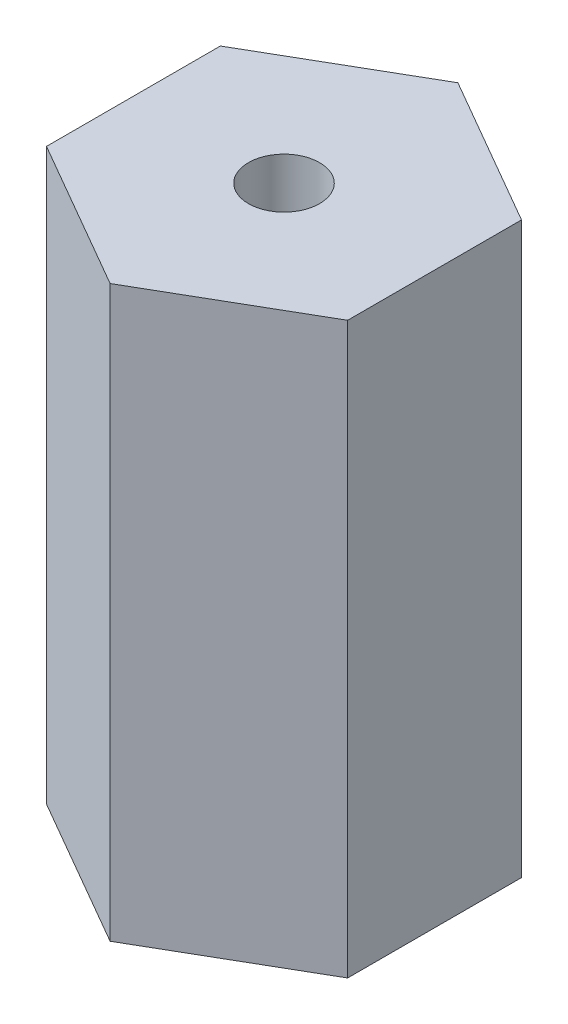
from build123d import *

# Parameters (mm, degrees)
SKETCH1_R           = 1.5
BOSS_EXTRUDE1_DEPTH = 24.0204498
SKETCH2_R           = 5
CUT_EXTRUDE1_DEPTH  = 2.54


with BuildPart() as part:
    # Sketch1 → Boss-Extrude1 (new body)
    with BuildSketch(Plane(origin=(0, 0, 0), x_dir=(1, 0, 0), z_dir=(0, 1, 0))):
        Polygon((0, 7.332348419), (-6.35, 3.666174209), (-6.35, -3.666174209), (0, -7.332348419), (6.35, -3.666174209), (6.35, 3.666174209), align=None)
        with Locations(Location((0, 0, 0), (0, 0, 270))):
            Circle(SKETCH1_R, mode=Mode.SUBTRACT)
    extrude(amount=BOSS_EXTRUDE1_DEPTH)

    # Sketch2 → Cut-Extrude1 (cut)
    with BuildSketch(Plane(origin=(0, 0, 0), x_dir=(1, 0, 0), z_dir=(0, 1, 0))):
        with Locations(Location((0, 0, 0), (0, 0, 270))):
            Circle(SKETCH2_R)
    extrude(amount=CUT_EXTRUDE1_DEPTH, mode=Mode.SUBTRACT)


solid = part.part
